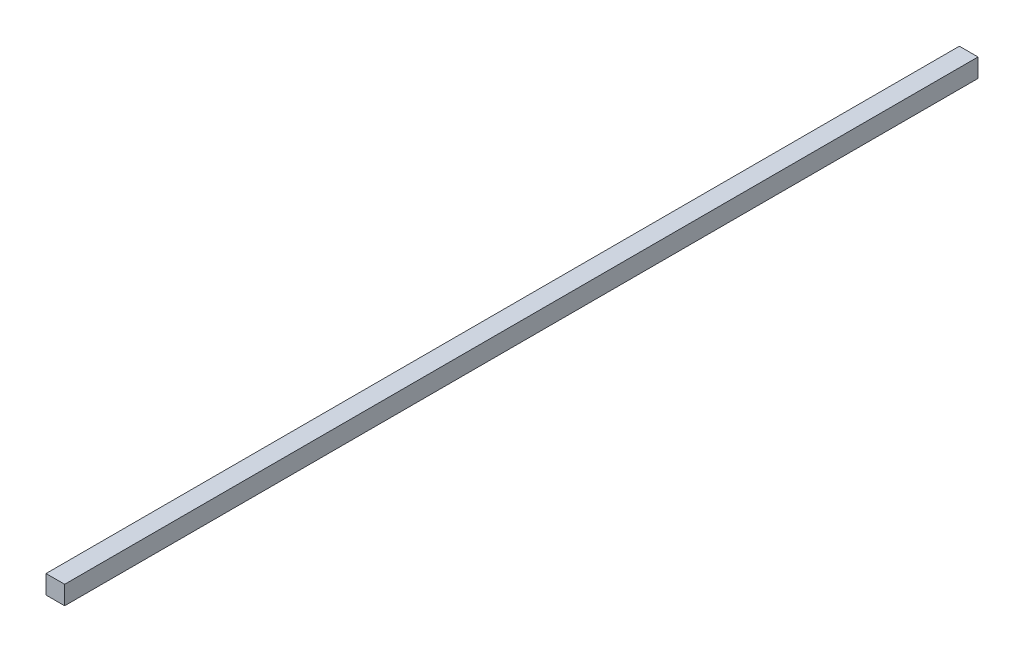
from build123d import *

# Parameters (mm, degrees)
SKETCH1_W           = 10
SKETCH1_H           = 10
BOSS_EXTRUDE1_DEPTH = 490


with BuildPart() as part:
    # Sketch1 → Boss-Extrude1 (new body)
    with BuildSketch(Plane.XY):
        with Locations((-2.419354839, 1.532258065)):
            Rectangle(SKETCH1_W, SKETCH1_H)
    extrude(amount=BOSS_EXTRUDE1_DEPTH)


solid = part.part
